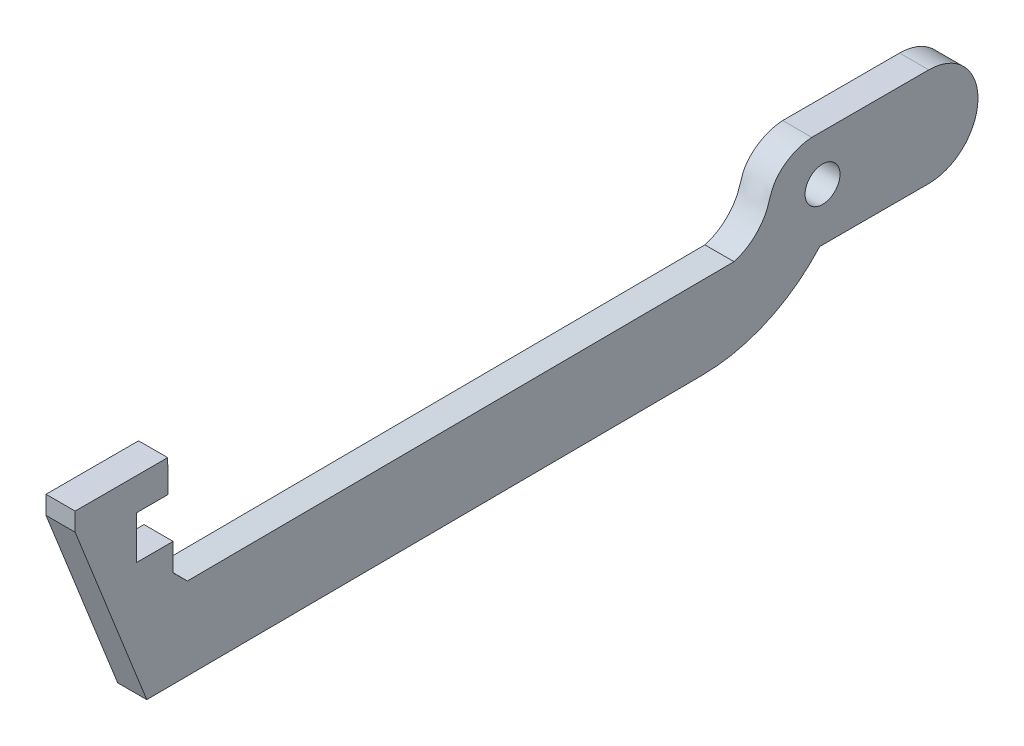
from build123d import *

# Parameters (mm, degrees)
SKETCH1_R           = 1.524
BOSS_EXTRUDE1_DEPTH = 2.54


with BuildPart() as part:
    # Sketch1 → Boss-Extrude1 (new body)
    with BuildSketch(Plane(origin=(0, 0, 0), x_dir=(0, 0, -1), z_dir=(1, 0, 0))):
        with BuildLine():
            Line((-50.098445601, 7.088580138), (-43.849100544, -8.683576435))
            Line((-43.849100544, -8.683576435), (4.658436215, -8.397602077))
            ThreePointArc((4.658436215, -8.397602077), (10.232240609, -7.180288327), (14.831146716, -3.804016594))
            Line((14.831146716, -3.804016594), (24.334060944, -3.804016594))
            ThreePointArc((24.334060944, -3.804016594), (28.629205553, 0.491128014), (24.334060944, 4.786272622))
            Line((24.334060944, 4.786272622), (14.134590219, 4.786272622))
            add(Edge.make_bspline(
                [(14.134590219, 4.786272622), (12.843386165, 4.731447756), (10.814047052, 3.6607913), (10.165897568, 0.480505822), (8.613444363, -0.857594594), (7.353623418, -1.210119508)],
                knots=[0, 0, 0, 0, 0.42442334, 0.587762542, 1, 1, 1, 1], degree=3))
            Line((7.353623418, -1.210119508), (-40.305133261, -1.491089915))
            Line((-40.305133261, -1.491089915), (-41.553433836, -0.257421693))
            Line((-41.553433836, -0.257421693), (-41.553433836, 2.122185781))
            Line((-41.553433836, 2.122185781), (-44.766052446, 2.122185781))
            Line((-44.766052446, 2.122185781), (-44.766052446, 5.877981651))
            Line((-44.766052446, 5.877981651), (-42.008654347, 5.877981651))
            Line((-42.008654347, 5.877981651), (-42.025194626, 8.683576435))
            Line((-42.025194626, 8.683576435), (-50.098445601, 8.683576435))
            Line((-50.098445601, 8.683576435), (-50.098445601, 7.088580138))
        make_face()
        with Locations((15.07250618, 0.779338165)):
            Circle(SKETCH1_R, mode=Mode.SUBTRACT)
    extrude(amount=BOSS_EXTRUDE1_DEPTH)


solid = part.part
